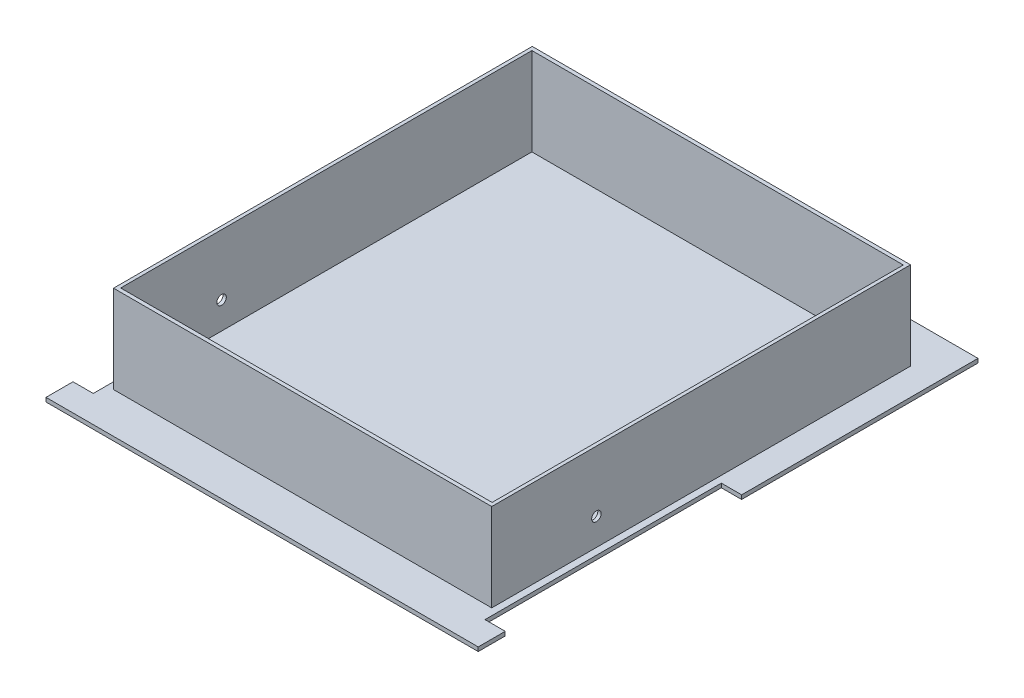
from build123d import *

# Parameters (mm, degrees)
SKETCH1_W           = 320
SKETCH1_H           = 370
BOSS_EXTRUDE1_DEPTH = 3
SKETCH2_W           = 280
SKETCH2_H           = 310
SKETCH2_W_2         = 275
SKETCH2_H_2         = 304.464285714
BOSS_EXTRUDE2_DEPTH = 65
SKETCH4_W           = 15
SKETCH4_H           = 175
CUT_EXTRUDE2_DEPTH  = 40
SKETCH5_R           = 3.5
CUT_EXTRUDE3_DEPTH  = 359.955428988
SKETCH6_W           = 38
SKETCH6_H           = 38
CUT_EXTRUDE5_DEPTH  = 2


with BuildPart() as part:
    # Sketch1 → Boss-Extrude1 (new body)
    with BuildSketch(Plane(origin=(0, 0, 0), x_dir=(1, 0, 0), z_dir=(0, 1, 0))):
        Rectangle(SKETCH1_W, SKETCH1_H)
    extrude(amount=BOSS_EXTRUDE1_DEPTH)

    # Sketch2 → Boss-Extrude2 (add)
    with BuildSketch(Plane(origin=(0, 3, 0), x_dir=(1, 0, 0), z_dir=(0, 1, 0))):
        Rectangle(SKETCH2_W, SKETCH2_H)
        Rectangle(SKETCH2_W_2, SKETCH2_H_2, mode=Mode.SUBTRACT)
    extrude(amount=BOSS_EXTRUDE2_DEPTH)

    # Sketch4 → Cut-Extrude2 (cut)
    with BuildSketch(Plane(origin=(0, 3, 0), x_dir=(1, 0, 0), z_dir=(0, 1, 0))):
        with Locations((-152.5, -77.5)):
            Rectangle(SKETCH4_W, SKETCH4_H)
    cut_extrude2 = extrude(amount=-CUT_EXTRUDE2_DEPTH, mode=Mode.SUBTRACT)

    # Mirror3: Cut-Extrude2 across plane
    add(cut_extrude2.mirror(Plane(origin=(0, 0, 0), x_dir=(0, 0, 1), z_dir=(1, 0, 0))), mode=Mode.SUBTRACT)

    # Sketch5 → Cut-Extrude3 (cut, through all)
    with BuildSketch(Plane(origin=(140, 0, 0), x_dir=(0, 0, -1), z_dir=(1, 0, 0))):
        with Locations((-77.5, 23)):
            Circle(SKETCH5_R)
    extrude(amount=-CUT_EXTRUDE3_DEPTH, mode=Mode.SUBTRACT)

    # Sketch6 → Cut-Extrude5 (cut)
    with BuildSketch(Plane.XZ):
        with Locations((-81, -116)):
            Rectangle(SKETCH6_W, SKETCH6_H)
        with Locations((81, -116)):
            Rectangle(SKETCH6_W, SKETCH6_H)
    extrude(amount=-CUT_EXTRUDE5_DEPTH, mode=Mode.SUBTRACT)


solid = part.part
